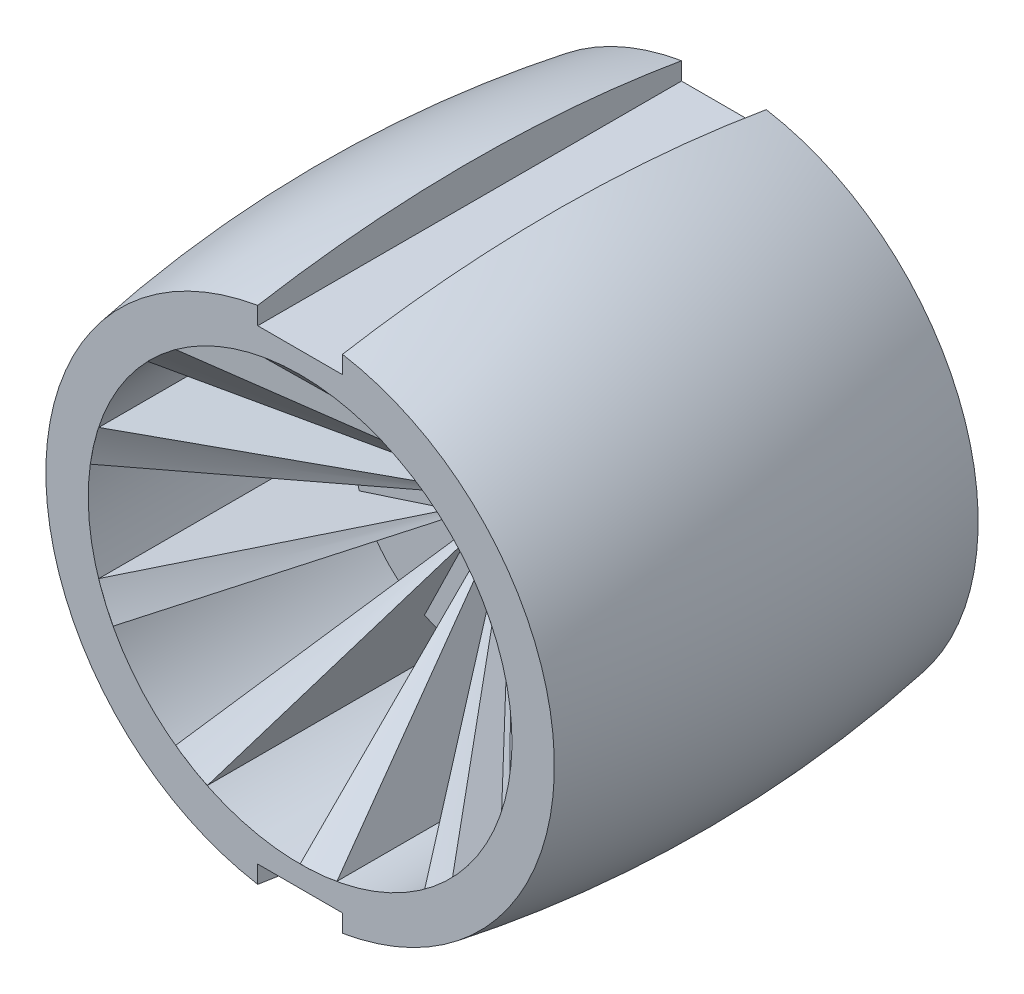
from build123d import *

# Parameters (mm, degrees)
SKETCH4_R           = 15
SKETCH4_R_2         = 3.75
BOSS_EXTRUDE1_DEPTH = 3.75
REVOLVE1_ANGLE      = 10
CIRPATTERN1_COUNT   = 10
SKETCH7_W           = 10
SKETCH7_H           = 7.5
CUT_EXTRUDE1_DEPTH  = 52.822426825


with BuildPart() as part:
    # Sweep1: sweep along a path in Sketch3
    with BuildLine(Plane.XY) as sweep1_path:
        CenterArc((0, 0), 30, 0, 360)
    # Sketch1 → Sweep1 (sweep)
    with BuildSketch(Plane(origin=(0, 0, 0), x_dir=(0, 0, -1), z_dir=(1, 0, 0))):
        with BuildLine():
            Line((-25, 30), (-25, 25))
            Line((-25, 25), (25, 25))
            Line((25, 25), (25, 30))
            ThreePointArc((25, 30), (0, 32.098005423), (-25, 30))
        make_face()
    sweep(path=sweep1_path.line)

    # Sketch7 → Cut-Extrude1 (cut, symmetric)
    with BuildSketch(Plane.XY):
        with Locations((0, 31.25)):
            Rectangle(SKETCH7_W, SKETCH7_H)
    cut_extrude1 = extrude(amount=CUT_EXTRUDE1_DEPTH, both=True, mode=Mode.SUBTRACT)

    # Mirror1: Cut-Extrude1 across plane
    add(cut_extrude1.mirror(Plane.ZX), mode=Mode.SUBTRACT)


with BuildPart() as body_2:
    # Sketch4 → Boss-Extrude1 (new, symmetric)
    with BuildSketch(Plane.XY):
        Circle(SKETCH4_R)
        Circle(SKETCH4_R_2, mode=Mode.SUBTRACT)
    extrude(amount=BOSS_EXTRUDE1_DEPTH, both=True)

    # Sketch6 → Revolve1 (revolve)
    with BuildSketch(Plane(origin=(0, 0, 0), x_dir=(0, 0, -1), z_dir=(1, 0, 0))):
        Polygon((-25, 25), (25, 25), (3.75, 3.75), (3.75, 15), (-3.75, 15), (-3.75, 3.75), align=None)
    revolve1 = revolve(axis=Axis((0, 0, -26.331150218), (0, 0, 1)), revolution_arc=REVOLVE1_ANGLE)

    # CirPattern1: Revolve1 ×10 about axis
    cirpattern1_axis = Axis((0, 0, 0), (0, 0, 1))
    for i in range(1, CIRPATTERN1_COUNT):
        add(revolve1.rotate(cirpattern1_axis, i * 360 / CIRPATTERN1_COUNT))


solid = Compound([part.part, body_2.part])
